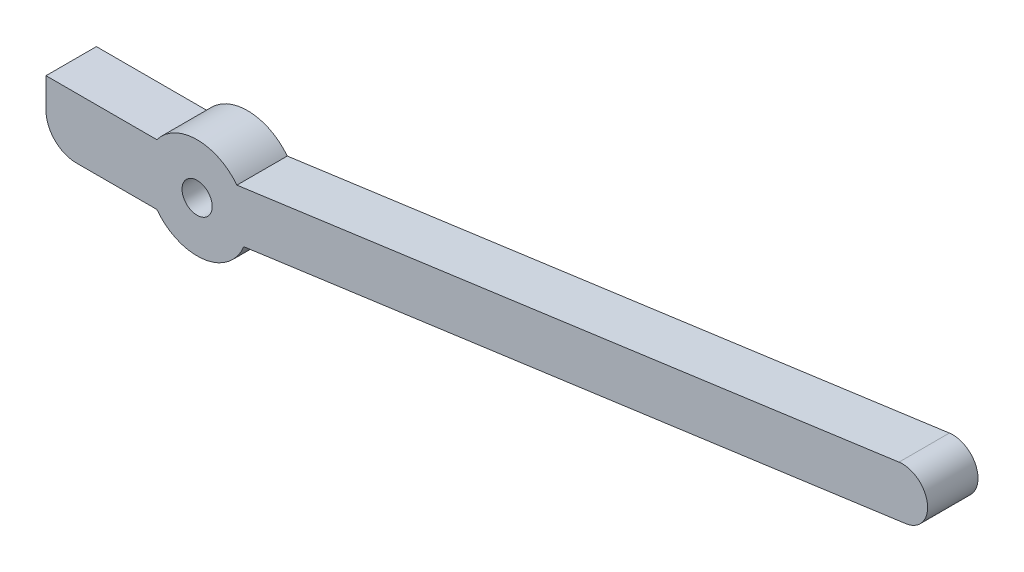
from build123d import *

# Parameters (mm, degrees)
SKETCH1_R           = 1.5
BOSS_EXTRUDE1_DEPTH = 5
FILLET1_R           = 3
BOSS_EXTRUDE2_START = -5
BOSS_EXTRUDE2_DEPTH = 5


with BuildPart() as part:
    # Sketch1 → Boss-Extrude1 (new body)
    with BuildSketch(Plane.XY):
        with BuildLine():
            Line((-15.5, -3), (-12.5, -3))
            Line((-12.5, -3), (-4.5, -3))
            ThreePointArc((-4.5, -3), (-0.5, -5), (3.5, -3))
            ThreePointArc((3.5, -3), (4.5, 0), (3.5, 3))
            ThreePointArc((3.5, 3), (-0.5, 5), (-4.5, 3))
            Line((-4.5, 3), (-12.5, 3))
            Line((-12.5, 3), (-15.5, 3))
            Line((-15.5, 3), (-15.5, -3))
        make_face()
        with Locations((-0.5, 0)):
            Circle(SKETCH1_R, mode=Mode.SUBTRACT)
    extrude(amount=BOSS_EXTRUDE1_DEPTH)

    # Fillet1
    fillet1_edges = [part.edges().sort_by_distance(p)[0] for p in [
        (-15.5, -3, 2.5),
    ]]
    fillet(fillet1_edges, radius=FILLET1_R)

    # Sketch2 → Boss-Extrude2 (add)
    with BuildSketch(Plane.XY.offset(5).offset(BOSS_EXTRUDE2_START)):
        with BuildLine():
            Line((4.130629225, -1.886073429), (69.840963555, 7.16038973))
            ThreePointArc((69.840963555, 7.16038973), (71.97663963, 9.977992914), (69.159036445, 12.113668989))
            Line((69.159036445, 12.113668989), (3.448702116, 3.06720583))
            ThreePointArc((3.448702116, 3.06720583), (4.453279259, 0.681927109), (4.130629225, -1.886073429))
        make_face()
    extrude(amount=BOSS_EXTRUDE2_DEPTH)


solid = part.part
